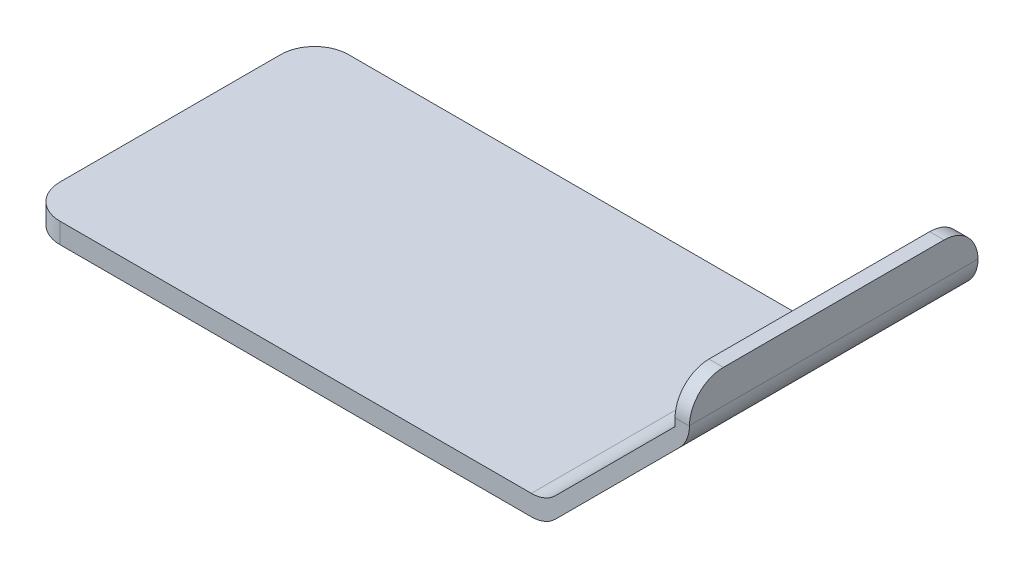
from build123d import *

# Parameters (mm, degrees)
SKETCH1_W           = 76.5
SKETCH1_H           = 42.5
BOSS_EXTRUDE1_DEPTH = 3
BOSS_EXTRUDE2_DEPTH = 42.5
FILLET1_R           = 5
FILLET2_R           = 5
FILLET3_R           = 5
FILLET4_R           = 5


with BuildPart() as part:
    # Sketch1 → Boss-Extrude1 (new body)
    with BuildSketch(Plane(origin=(0, 0, 0), x_dir=(1, 0, 0), z_dir=(0, 1, 0))):
        with Locations((38.25, 21.25)):
            Rectangle(SKETCH1_W, SKETCH1_H)
    extrude(amount=BOSS_EXTRUDE1_DEPTH)

    # Sketch2 → Boss-Extrude2 (add)
    with BuildSketch(Plane.XY):
        Polygon((76.5, 3), (76.5, 0), (97.713203436, 21.213203436), (97.713203436, 28.213203436), (95.591883092, 28.213203436), (95.591883092, 22.091883092), align=None)
    extrude(amount=-BOSS_EXTRUDE2_DEPTH)

    # Fillet1
    fillet1_edges = [part.edges().sort_by_distance(p)[0] for p in [
        (97.713203436, 21.213203436, -21.25),
        (76.5, 0, -21.25),
    ]]
    fillet(fillet1_edges, radius=FILLET1_R)

    # Fillet2
    fillet2_edges = [part.edges().sort_by_distance(p)[0] for p in [
        (0, 1.5, -42.5),
        (0, 1.5, 0),
    ]]
    fillet(fillet2_edges, radius=FILLET2_R)

    # Fillet3
    fillet3_edges = [part.edges().sort_by_distance(p)[0] for p in [
        (96.652543264, 28.213203436, 0),
        (96.652543264, 28.213203436, -42.5),
    ]]
    fillet(fillet3_edges, radius=FILLET3_R)

    # Fillet4
    fillet4_edges = [part.edges().sort_by_distance(p)[0] for p in [
        (76.5, 3, -21.25),
    ]]
    fillet(fillet4_edges, radius=FILLET4_R)


solid = part.part
